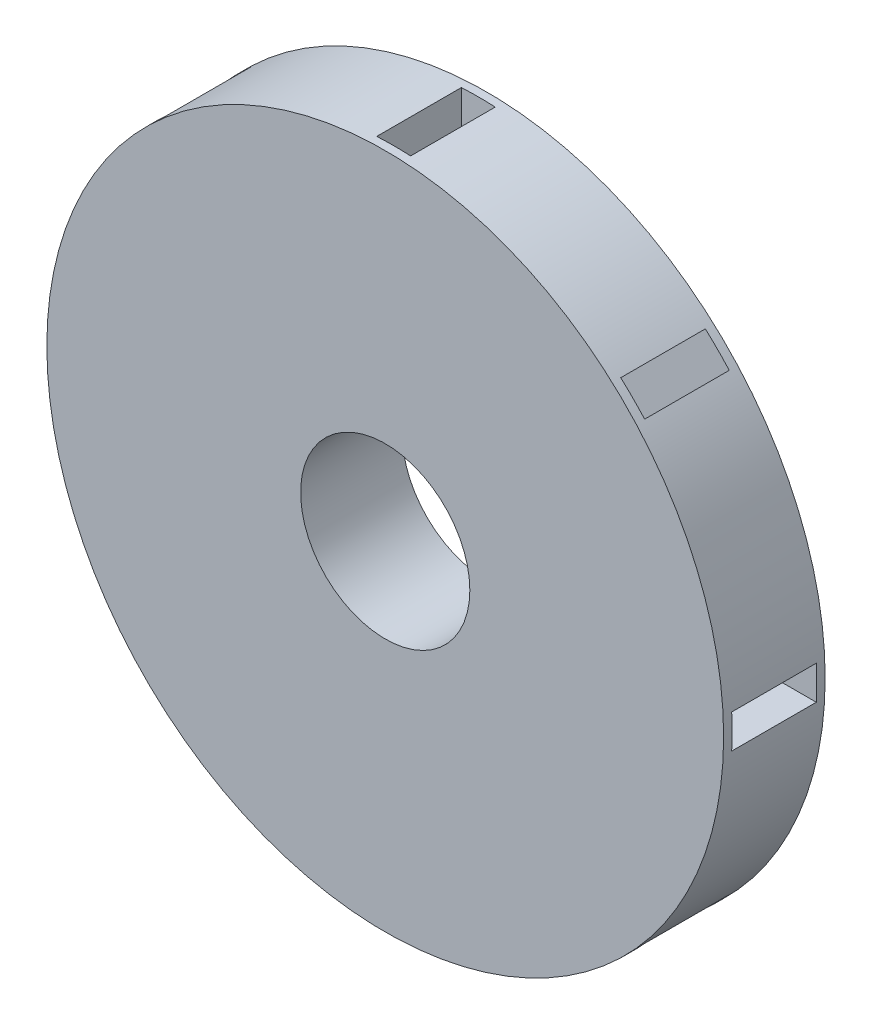
from build123d import *

# Parameters (mm, degrees)
SKETCH1_R           = 100
SKETCH1_R_2         = 25
BOSS_EXTRUDE1_DEPTH = 15
CUT_EXTRUDE1_DEPTH  = 12.5


with BuildPart() as part:
    # Sketch1 → Boss-Extrude1 (new, symmetric)
    with BuildSketch(Plane.XY):
        Circle(SKETCH1_R)
        Circle(SKETCH1_R_2, mode=Mode.SUBTRACT)
    extrude(amount=BOSS_EXTRUDE1_DEPTH, both=True)

    # Sketch2 → Cut-Extrude1 (cut, symmetric)
    with BuildSketch(Plane.XY):
        Polygon((100, 5), (110, -5), (100, -5), (60, -5), (60, 5), align=None)
        Polygon((45.961940777, -38.890872965), (74.246212025, -67.175144213), (74.246212025, -81.317279836), (67.175144213, -74.246212025), (38.890872965, -45.961940777), align=None)
        Polygon((5, -60), (5, -100), (-5, -110), (-5, -100), (-5, -60), align=None)
        Polygon((-38.890872965, -45.961940777), (-67.175144213, -74.246212025), (-81.317279836, -74.246212025), (-74.246212025, -67.175144213), (-45.961940777, -38.890872965), align=None)
        Polygon((-60, -5), (-100, -5), (-110, 5), (-100, 5), (-60, 5), align=None)
        Polygon((-45.961940777, 38.890872965), (-74.246212025, 67.175144213), (-74.246212025, 81.317279836), (-67.175144213, 74.246212025), (-38.890872965, 45.961940777), align=None)
        Polygon((-5, 60), (-5, 100), (5, 110), (5, 100), (5, 60), align=None)
        Polygon((38.890872965, 45.961940777), (67.175144213, 74.246212025), (81.317279836, 74.246212025), (74.246212025, 67.175144213), (45.961940777, 38.890872965), align=None)
    extrude(amount=CUT_EXTRUDE1_DEPTH, both=True, mode=Mode.SUBTRACT)


solid = part.part
